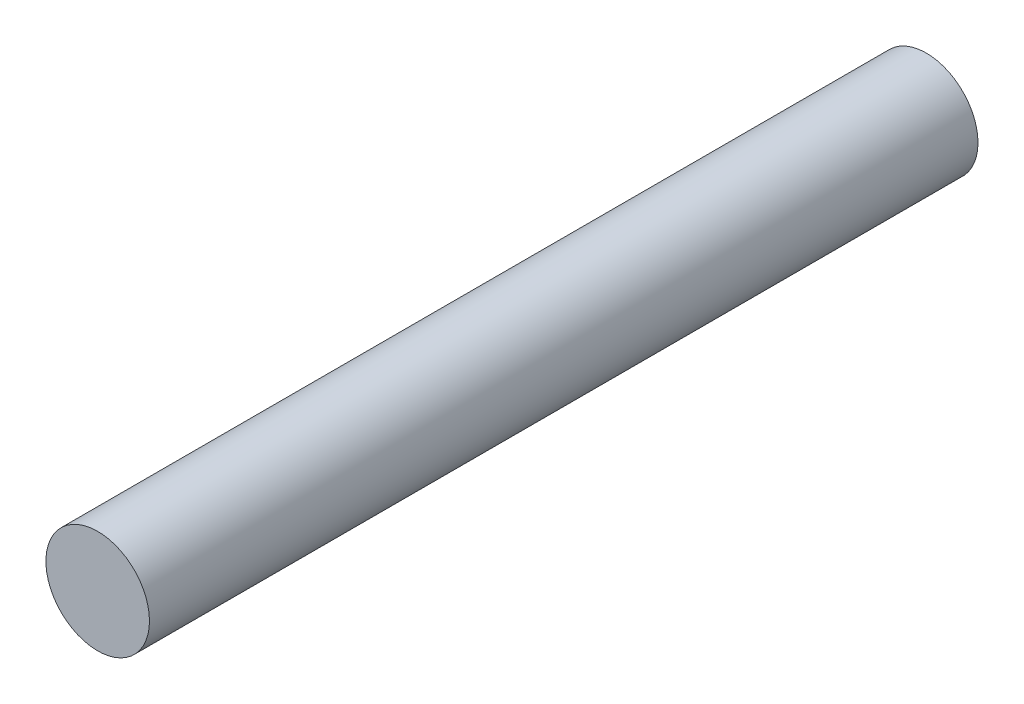
from build123d import *

# Parameters (mm, degrees)
SKETCH1_R           = 3.96875
BOSS_EXTRUDE1_DEPTH = 31.75


with BuildPart() as part:
    # Sketch1 → Boss-Extrude1 (new, symmetric)
    with BuildSketch(Plane.XY):
        Circle(SKETCH1_R)
    extrude(amount=BOSS_EXTRUDE1_DEPTH, both=True)


solid = part.part
